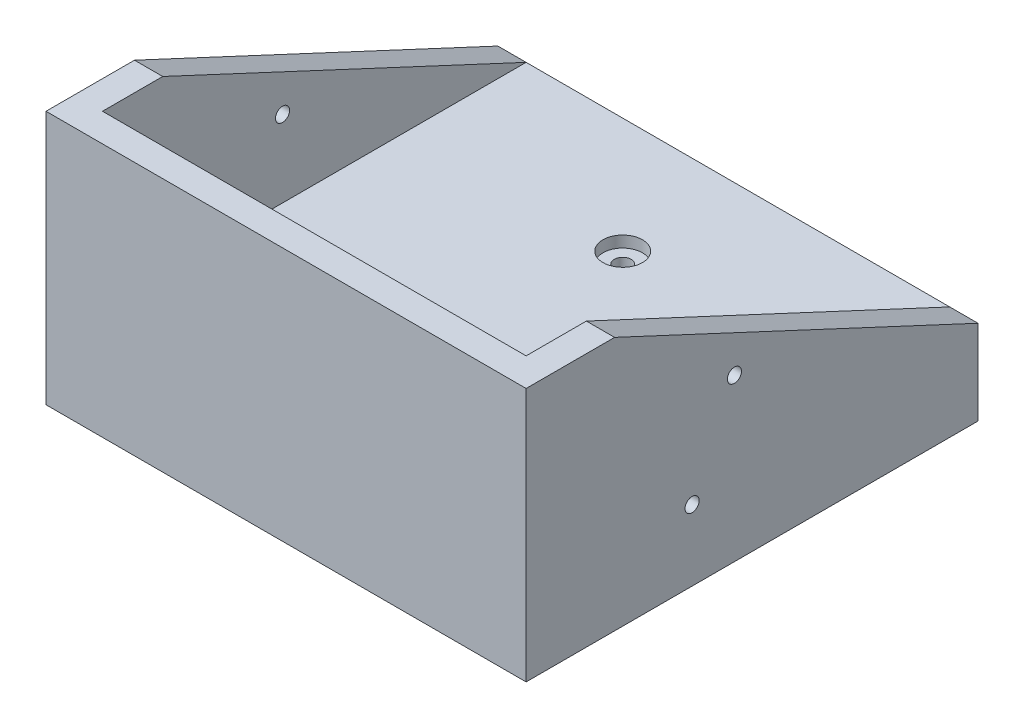
from build123d import *

# Parameters (mm, degrees)
SKETCH1_W           = 85
SKETCH1_H           = 80
BOSS_EXTRUDE1_DEPTH = 5
SKETCH2_R           = 1.5
CUT_EXTRUDE1_DEPTH  = 59.576872569
BOSS_EXTRUDE3_DEPTH = 30
SKETCH5_R           = 3.5
CUT_EXTRUDE2_DEPTH  = 2
SKETCH6_R           = 1.25
CUT_EXTRUDE3_DEPTH  = 101.249688279
SKETCH3_W           = 85
SKETCH3_H           = 80
BOSS_EXTRUDE4_DEPTH = 10


with BuildPart() as part:
    # Sketch1 → Boss-Extrude1 (new body)
    with BuildSketch(Plane(origin=(0, 0, 0), x_dir=(1, 0, 0), z_dir=(0, 1, 0))):
        Rectangle(SKETCH1_W, SKETCH1_H)
    extrude(amount=BOSS_EXTRUDE1_DEPTH)

    # Sketch2 → Cut-Extrude1 (cut, through all)
    with BuildSketch(Plane.XZ):
        with Locations(Location((0, 19.6, 0), (0, 0, 270))):
            Circle(SKETCH2_R)
        with Locations(Location((0, -19.6, 0), (0, 0, 90))):
            Circle(SKETCH2_R)
    extrude(amount=-CUT_EXTRUDE1_DEPTH, mode=Mode.SUBTRACT)

    # Sketch4 → Boss-Extrude3 (add)
    with BuildSketch(Plane(origin=(0, 5, 0), x_dir=(1, 0, 0), z_dir=(0, 1, 0))):
        Polygon((-42.5, -40), (-42.5, 40), (-37.5, 40), (-37.5, -35), (37.5, -35), (37.5, 40), (42.5, 40), (42.5, -40), align=None)
    extrude(amount=BOSS_EXTRUDE3_DEPTH)

    # Sketch5 → Cut-Extrude2 (cut)
    with BuildSketch(Plane(origin=(0, 5, 0), x_dir=(1, 0, 0), z_dir=(0, 1, 0))):
        with Locations(Location((0, 19.6, 0), (0, 0, 270))):
            Circle(SKETCH5_R)
        with Locations(Location((0, -19.6, 0), (0, 0, 270))):
            Circle(SKETCH5_R)
    extrude(amount=-CUT_EXTRUDE2_DEPTH, mode=Mode.SUBTRACT)

    # Sketch6 → Cut-Extrude3 (cut, through all)
    with BuildSketch(Plane.ZY.offset(42.5)):
        with Locations((10.624581332, 2.504153155)):
            Circle(SKETCH6_R)
        with Locations((3.123107186, 18.591116375)):
            Circle(SKETCH6_R)
        Polygon((24.335207615, 35), (-40, 5), (-40, 35), align=None)
    extrude(amount=-CUT_EXTRUDE3_DEPTH, mode=Mode.SUBTRACT)

    # Sketch3 → Boss-Extrude4 (add)
    with BuildSketch(Plane.XZ):
        Rectangle(SKETCH3_W, SKETCH3_H)
        Polygon((29.5, -17), (32, -17), (32, -5), (29.5, -5), (29.5, 24), (-29.5, 24), (-29.5, -24), (29.5, -24), align=None, mode=Mode.SUBTRACT)
    extrude(amount=BOSS_EXTRUDE4_DEPTH)


solid = part.part
